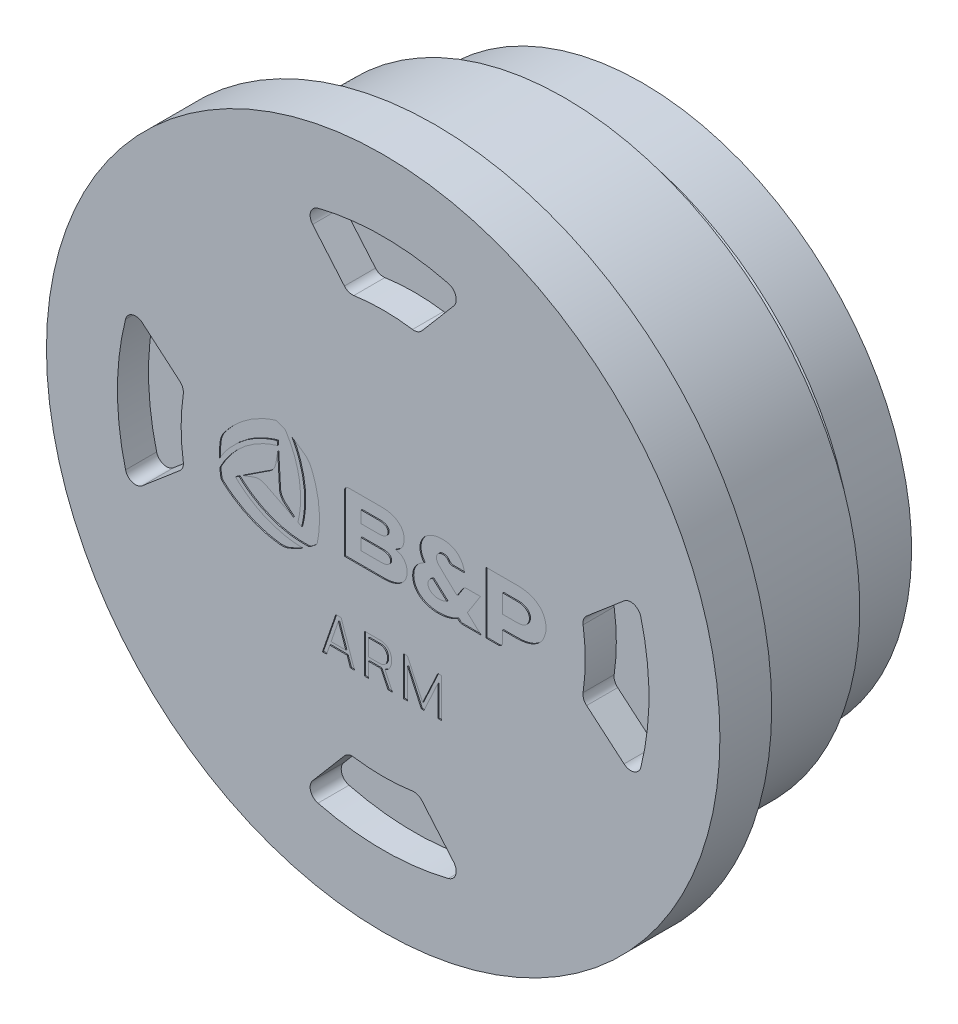
from build123d import *

# Parameters (mm, degrees)
CORTAR_EXTRUIR1_DEPTH = 0.1
CORTAR_EXTRUIR2_DEPTH = 3
MATRIZC1_COUNT        = 4
REDONDEO1_R           = 1


with BuildPart() as part:
    # Croquis1 → Revolución1 (revolve)
    with BuildSketch(Plane(origin=(0, 0, 0), x_dir=(0, 0, -1), z_dir=(1, 0, 0))):
        with BuildLine():
            Line((0, 20), (-20, 20))
            Line((-20, 20), (-20, 0))
            Line((-20, 0), (-25, 0))
            Line((-25, 0), (-25, 32.5))
            Line((-25, 32.5), (-20, 32.5))
            Line((-20, 32.5), (-20, 28.5))
            Line((-20, 28.5), (-7.5, 28.5))
            Line((-7.5, 28.5), (-7.5, 26))
            ThreePointArc((-7.5, 26), (-6.5, 25.618033989), (-5.5, 26))
            Line((-5.5, 26), (0, 26))
            Line((0, 26), (0, 20))
        make_face()
    revolve(axis=Axis((0, 0, 20), (0, 0, 1)))

    # Croquis2 → Cortar-Extruir1 (cut)
    # profile 1 of 7: a face of its own
    with BuildSketch(Plane.XY.offset(25)):
        with BuildLine():
            Line((12.994078069, 2.960293032), (9.929828115, 2.960293032))
            Line((9.929828115, 2.960293032), (9.929828115, -2.948296044))
            Line((9.929828115, -2.948296044), (11.106882982, -2.948296044))
            add(Edge.make_bspline(
                [(11.106882982, -2.948296044), (11.341278499, -2.948296044), (11.53192279, -2.757643262), (11.53192279, -2.523247745)],
                knots=[6, 6, 6, 6, 7, 7, 7, 7], degree=3))
            Line((11.53192279, -2.523247745), (11.53192279, -1.497959455))
            Line((11.53192279, -1.497959455), (12.861372525, -1.497959455))
            add(Edge.make_bspline(
                [(12.861372525, -1.497959455), (13.44013171, -1.497959455), (13.952045678, -1.402535424), (14.382926907, -1.214319398)],
                knots=[9, 9, 9, 9, 10, 10, 10, 10], degree=3))
            add(Edge.make_bspline(
                [(14.382926907, -1.214319398), (14.813748703, -1.026111863), (15.148645532, -0.754918789), (15.378311875, -0.408262703)],
                knots=[10, 10, 10, 10, 11, 11, 11, 11], degree=3))
            add(Edge.make_bspline(
                [(15.378311875, -0.408262703), (15.490504521, -0.238827526), (15.722675543, 0.272322303), (15.72378779, 0.771160996)],
                knots=[11, 11, 11, 11, 12, 12, 12, 12], degree=3))
            add(Edge.make_bspline(
                [(15.72378779, 0.771160996), (15.724967961, 1.285087198), (15.478889602, 1.77537602), (15.392567321, 1.906621208)],
                knots=[12, 12, 12, 12, 13, 13, 13, 13], degree=3))
            add(Edge.make_bspline(
                [(15.392567321, 1.906621208), (15.172291402, 2.24117842), (14.853322634, 2.503320688), (14.444482581, 2.685627369)],
                knots=[1, 1, 1, 1, 2, 2, 2, 2], degree=3))
            add(Edge.make_bspline(
                [(14.444482581, 2.685627369), (14.035370834, 2.867925559), (13.547382921, 2.960293032), (12.994078069, 2.960293032)],
                knots=[2, 2, 2, 2, 3, 3, 3, 3], degree=3))
        make_face()
        with BuildLine():
            Line((12.956176754, -0.165172977), (11.53192279, -0.165172977))
            Line((11.53192279, -0.165172977), (11.53192279, 1.618464239))
            Line((11.53192279, 1.618464239), (12.956176754, 1.618464239))
            add(Edge.make_bspline(
                [(12.956176754, 1.618464239), (13.308326153, 1.618464239), (13.593774673, 1.536667361), (13.804592244, 1.3752981)],
                knots=[5, 5, 5, 5, 6, 6, 6, 6], degree=3))
            add(Edge.make_bspline(
                [(13.804592244, 1.3752981), (13.940014727, 1.271527968), (14.033282187, 1.142091244), (14.08183051, 0.990460515)],
                knots=[6, 6, 6, 6, 7, 7, 7, 7], degree=3))
            add(Edge.make_bspline(
                [(14.08183051, 0.990460515), (14.126277952, 0.851837136), (14.128086416, 0.698406434), (14.08705213, 0.546852119)],
                knots=[7, 7, 7, 7, 8, 8, 8, 8], degree=3))
            add(Edge.make_bspline(
                [(14.08705213, 0.546852119), (14.040032085, 0.373171723), (13.945015595, 0.224470195), (13.804592244, 0.105043697)],
                knots=[0, 0, 0, 0, 1, 1, 1, 1], degree=3))
            add(Edge.make_bspline(
                [(13.804592244, 0.105043697), (13.593706749, -0.07426586), (13.30825823, -0.165172977), (12.956176754, -0.165172977)],
                knots=[1, 1, 1, 1, 2, 2, 2, 2], degree=3))
        make_face(mode=Mode.SUBTRACT)
    # profile 2 of 7: a face of its own
    with BuildSketch(Plane.XY.offset(25)):
        with BuildLine():
            Line((8.128700597, -1.723168318), (8.166678326, -1.669126681))
            Line((8.166678326, -1.669126681), (9.389564576, 0.249160388))
            Line((9.389564576, 0.249160388), (8.046971643, 0.249160388))
            add(Edge.make_bspline(
                [(8.046971643, 0.249160388), (7.902235149, 0.249160388), (7.768901314, 0.176618088), (7.690228917, 0.055179355)],
                knots=[3, 3, 3, 3, 4, 4, 4, 4], degree=3))
            Line((7.690228917, 0.055179355), (7.133315629, -0.804502946))
            Line((7.133315629, -0.804502946), (6.071509965, 0.177178456))
            add(Edge.make_bspline(
                [(6.071509965, 0.177178456), (5.712958776, 0.50574991), (5.465768169, 0.749603775), (5.336883323, 0.902066567)],
                knots=[6, 6, 6, 6, 7, 7, 7, 7], degree=3))
            add(Edge.make_bspline(
                [(5.336883323, 0.902066567), (5.207930553, 1.054385021), (5.142554182, 1.216518422), (5.142554182, 1.383864951)],
                knots=[7, 7, 7, 7, 8, 8, 8, 8], degree=3))
            add(Edge.make_bspline(
                [(5.142554182, 1.383864951), (5.142554182, 1.557256673), (5.201528763, 1.698104546), (5.317966627, 1.802647306)],
                knots=[8, 8, 8, 8, 9, 9, 9, 9], degree=3))
            add(Edge.make_bspline(
                [(5.317966627, 1.802647306), (5.434396001, 1.9072495), (5.582689988, 1.960323227), (5.758730726, 1.960323227)],
                knots=[9, 9, 9, 9, 10, 10, 10, 10], degree=3))
            add(Edge.make_bspline(
                [(5.758730726, 1.960323227), (5.941028916, 1.960323227), (6.094187924, 1.899667539), (6.21375027, 1.780181608)],
                knots=[10, 10, 10, 10, 11, 11, 11, 11], degree=3))
            add(Edge.make_bspline(
                [(6.21375027, 1.780181608), (6.249291242, 1.744564221), (6.280935104, 1.703742196), (6.307781869, 1.658734385)],
                knots=[11, 11, 11, 11, 12, 12, 12, 12], degree=3))
            add(Edge.make_bspline(
                [(6.307781869, 1.658734385), (6.382344894, 1.533814574), (6.523676722, 1.456262915), (6.676555545, 1.456262915)],
                knots=[12, 12, 12, 12, 13, 13, 13, 13], degree=3))
            Line((6.676555545, 1.456262915), (7.851385917, 1.456262915))
            Line((7.851385917, 1.456262915), (7.848117099, 1.476996564))
            add(Edge.make_bspline(
                [(7.848117099, 1.476996564), (7.769317345, 1.975835257), (7.560724269, 2.382374401), (7.228119857, 2.685279261)],
                knots=[15, 15, 15, 15, 16, 16, 16, 16], degree=3))
            add(Edge.make_bspline(
                [(7.228119857, 2.685279261), (6.850719896, 3.028878789), (6.340402131, 3.203102573), (5.711362573, 3.203102573)],
                knots=[16, 16, 16, 16, 17, 17, 17, 17], degree=3))
            add(Edge.make_bspline(
                [(5.711362573, 3.203102573), (5.283741672, 3.203102573), (4.902588938, 3.122774541), (4.578474964, 2.964470328)],
                knots=[17, 17, 17, 17, 18, 18, 18, 18], degree=3))
            add(Edge.make_bspline(
                [(4.578474964, 2.964470328), (4.254556271, 2.806098191), (3.999367671, 2.589430708), (3.820126039, 2.320538542)],
                knots=[18, 18, 18, 18, 19, 19, 19, 19], degree=3))
            add(Edge.make_bspline(
                [(3.820126039, 2.320538542), (3.640816482, 2.051646377), (3.549909364, 1.748597179), (3.549909364, 1.419889879)],
                knots=[19, 19, 19, 19, 20, 20, 20, 20], degree=3))
            add(Edge.make_bspline(
                [(3.549909364, 1.419889879), (3.549909364, 1.061202843), (3.680670597, 0.700563006), (3.938508213, 0.348209836)],
                knots=[20, 20, 20, 20, 21, 21, 21, 21], degree=3))
            add(Edge.make_bspline(
                [(3.938508213, 0.348209836), (3.604995325, 0.174741701), (3.337079559, -0.049499253), (3.142257973, -0.318255571)],
                knots=[21, 21, 21, 21, 22, 22, 22, 22], degree=3))
            add(Edge.make_bspline(
                [(3.142257973, -0.318255571), (2.94730054, -0.587079814), (2.84839543, -0.905216519), (2.84839543, -1.263835632)],
                knots=[22, 22, 22, 22, 23, 23, 23, 23], degree=3))
            add(Edge.make_bspline(
                [(2.84839543, -1.263835632), (2.84839543, -1.640539377), (2.950425021, -1.978365408), (3.151716321, -2.267982732)],
                knots=[23, 23, 23, 23, 24, 24, 24, 24], degree=3))
            add(Edge.make_bspline(
                [(3.151716321, -2.267982732), (3.353007621, -2.557888732), (3.643185314, -2.786578675), (4.014387256, -2.947939445)],
                knots=[24, 24, 24, 24, 25, 25, 25, 25], degree=3))
            add(Edge.make_bspline(
                [(4.014387256, -2.947939445), (4.38553477, -3.109297194), (4.819271323, -3.191072128), (5.303718724, -3.191057101)],
                knots=[25, 25, 25, 25, 26, 26, 26, 26], degree=3))
            add(Edge.make_bspline(
                [(5.303718724, -3.191057101), (6.027214402, -3.191046281), (6.655555206, -3.021397936), (7.171293357, -2.686765087)],
                knots=[26, 26, 26, 26, 27, 27, 27, 27], degree=3))
            Line((7.171293357, -2.686765087), (7.34607751, -2.841520298))
            add(Edge.make_bspline(
                [(7.34607751, -2.841520298), (7.423773507, -2.910386239), (7.523858788, -2.948287553), (7.627773256, -2.948287553)],
                knots=[29, 29, 29, 29, 30, 30, 30, 30], degree=3))
            Line((7.627773256, -2.948287553), (9.453276821, -2.948287553))
            Line((9.453276821, -2.948287553), (8.128700597, -1.723168318))
        make_face()
        with BuildLine():
            Line((4.772804105, -0.543405002), (6.147397498, -1.777209955))
            add(Edge.make_bspline(
                [(6.147397498, -1.777209955), (5.883226016, -1.902690135), (5.612109355, -1.966334457), (5.341612497, -1.966334457)],
                knots=[0, 0, 0, 0, 1, 1, 1, 1], degree=3))
            add(Edge.make_bspline(
                [(5.341612497, -1.966334457), (5.058388472, -1.966334457), (4.81439876, -1.892043126), (4.616376279, -1.745634016)],
                knots=[1, 1, 1, 1, 2, 2, 2, 2], degree=3))
            add(Edge.make_bspline(
                [(4.616376279, -1.745634016), (4.418285874, -1.59929283), (4.317784561, -1.419015364), (4.317784561, -1.209793995)],
                knots=[2, 2, 2, 2, 3, 3, 3, 3], degree=3))
            add(Edge.make_bspline(
                [(4.317784561, -1.209793995), (4.317784561, -1.072359278), (4.359234879, -0.945070634), (4.441031757, -0.831561971)],
                knots=[3, 3, 3, 3, 4, 4, 4, 4], degree=3))
            add(Edge.make_bspline(
                [(4.441031757, -0.831561971), (4.522692788, -0.718053308), (4.634325064, -0.621160431), (4.772804105, -0.543405002)],
                knots=[4, 4, 4, 4, 5, 5, 5, 5], degree=3))
        make_face(mode=Mode.SUBTRACT)
    # profile 3 of 7: a face of its own
    with BuildSketch(Plane.XY.offset(25)):
        with BuildLine():
            Line((-0.194526544, 2.960301523), (-3.313803024, 2.960301523))
            add(Edge.make_bspline(
                [(-3.313803024, 2.960301523), (-3.548198541, 2.960301523), (-3.738842832, 2.769657232), (-3.738842832, 2.535261715)],
                knots=[6, 6, 6, 6, 7, 7, 7, 7], degree=3))
            Line((-3.738842832, 2.535261715), (-3.738842832, -2.948355477))
            Line((-3.738842832, -2.948355477), (-0.004926577, -2.948355477))
            add(Edge.make_bspline(
                [(-0.004926577, -2.948355477), (0.705909859, -2.948355477), (1.275210696, -2.792275758), (1.687243153, -2.484497387)],
                knots=[9, 9, 9, 9, 10, 10, 10, 10], degree=3))
            add(Edge.make_bspline(
                [(1.687243153, -2.484497387), (2.099284101, -2.176727507), (2.308148871, -1.760101723), (2.308148871, -1.246234954)],
                knots=[10, 10, 10, 10, 11, 11, 11, 11], degree=3))
            add(Edge.make_bspline(
                [(2.308148871, -1.246234954), (2.308148871, -1.177793535), (2.303835729, -1.1086559), (2.295285858, -1.040842773)],
                knots=[11, 11, 11, 11, 12, 12, 12, 12], degree=3))
            add(Edge.make_bspline(
                [(2.295285858, -1.040842773), (2.264958014, -0.799213403), (2.174466927, -0.57789316), (2.026393692, -0.38300365)],
                knots=[0, 0, 0, 0, 1, 1, 1, 1], degree=3))
            add(Edge.make_bspline(
                [(2.026393692, -0.38300365), (1.846871874, -0.146944007), (1.563995958, 0.017133704), (1.208093785, 0.091560881)],
                knots=[1, 1, 1, 1, 2, 2, 2, 2], degree=3))
            add(Edge.make_bspline(
                [(1.208093785, 0.091560881), (1.82176565, 0.38764792), (1.992100813, 0.730755003), (2.023812599, 1.330239346)],
                knots=[2, 2, 2, 2, 3, 3, 3, 3], degree=3))
            add(Edge.make_bspline(
                [(2.023812599, 1.330239346), (2.023812599, 1.832066674), (1.826078792, 2.233537026), (1.436019588, 2.523502459)],
                knots=[3, 3, 3, 3, 4, 4, 4, 4], degree=3))
            add(Edge.make_bspline(
                [(1.436019588, 2.523502459), (1.045824537, 2.813399968), (0.497248859, 2.960301523), (-0.194526544, 2.960301523)],
                knots=[4, 4, 4, 4, 5, 5, 5, 5], degree=3))
        make_face()
        with BuildLine():
            Line((-0.441029425, 0.573359266), (-2.136748157, 0.573359266))
            Line((-2.136748157, 0.573359266), (-2.136748157, 1.717513686))
            Line((-2.136748157, 1.717513686), (-0.441029425, 1.717513686))
            add(Edge.make_bspline(
                [(-0.441029425, 1.717513686), (-0.132970869, 1.717513686), (0.101424648, 1.665976729), (0.255763826, 1.564431092)],
                knots=[5, 5, 5, 5, 6, 6, 6, 6], degree=3))
            add(Edge.make_bspline(
                [(0.255763826, 1.564431092), (0.335607904, 1.511705474), (0.395567376, 1.445488549), (0.433961135, 1.367656705)],
                knots=[6, 6, 6, 6, 7, 7, 7, 7], degree=3))
            add(Edge.make_bspline(
                [(0.433961135, 1.367656705), (0.492247991, 1.249418868), (0.49301213, 1.103357866), (0.43618563, 0.976909776)],
                knots=[7, 7, 7, 7, 8, 8, 8, 8], degree=3))
            add(Edge.make_bspline(
                [(0.43618563, 0.976909776), (0.396331515, 0.888227153), (0.332483423, 0.81157548), (0.246305479, 0.748983973)],
                knots=[0, 0, 0, 0, 1, 1, 1, 1], degree=3))
            add(Edge.make_bspline(
                [(0.246305479, 0.748983973), (0.085912618, 0.632410261), (-0.145349928, 0.573359266), (-0.441029425, 0.573359266)],
                knots=[1, 1, 1, 1, 2, 2, 2, 2], degree=3))
        make_face(mode=Mode.SUBTRACT)
        with BuildLine():
            Line((-0.213519653, -1.687483008), (-2.136748157, -1.687483008))
            Line((-2.136748157, -1.687483008), (-2.136748157, -0.588395832))
            Line((-2.136748157, -0.588395832), (-0.185000272, -0.588395832))
            add(Edge.make_bspline(
                [(-0.185000272, -0.588395832), (0.11039904, -0.588395832), (0.340065384, -0.636876232), (0.497529043, -0.732512523)],
                knots=[6, 6, 6, 6, 7, 7, 7, 7], degree=3))
            add(Edge.make_bspline(
                [(0.497529043, -0.732512523), (0.585167343, -0.785857944), (0.649159772, -0.854647471), (0.687833717, -0.936996228)],
                knots=[7, 7, 7, 7, 8, 8, 8, 8], degree=3))
            add(Edge.make_bspline(
                [(0.687833717, -0.936996228), (0.735889595, -1.039382417), (0.737214103, -1.161381519), (0.691374229, -1.271621363)],
                knots=[0, 0, 0, 0, 1, 1, 1, 1], degree=3))
            add(Edge.make_bspline(
                [(0.691374229, -1.271621363), (0.652912546, -1.364133174), (0.587672022, -1.444953651), (0.497529043, -1.511858301)],
                knots=[1, 1, 1, 1, 2, 2, 2, 2], degree=3))
            add(Edge.make_bspline(
                [(0.497529043, -1.511858301), (0.340269154, -1.628432013), (0.101008616, -1.687483008), (-0.213519653, -1.687483008)],
                knots=[2, 2, 2, 2, 3, 3, 3, 3], degree=3))
        make_face(mode=Mode.SUBTRACT)
    # profile 4 of 7: a face of its own
    with BuildSketch(Plane.XY.offset(25)):
        with BuildLine():
            Line((-7.869228572, -2.537732432), (-8.231464612, -2.355086134))
            add(Edge.make_bspline(
                [(-8.231464612, -2.355086134), (-8.116355501, -1.884070605), (-8.037479333, -1.397823231), (-7.998601619, -0.898984538)],
                knots=[6, 6, 6, 6, 7, 7, 7, 7], degree=3))
            add(Edge.make_bspline(
                [(-7.998601619, -0.898984538), (-7.840017221, 1.133999857), (-8.366398895, 3.065302767), (-9.383137314, 4.667465366)],
                knots=[7, 7, 7, 7, 8, 8, 8, 8], degree=3))
            add(Edge.make_bspline(
                [(-9.383137314, 4.667465366), (-9.431613469, 4.743836854), (-9.501931275, 4.803864249), (-9.585048416, 4.839685406)],
                knots=[8, 8, 8, 8, 9, 9, 9, 9], degree=3))
            add(Edge.make_bspline(
                [(-9.585048416, 4.839685406), (-9.779313879, 4.923358671), (-9.977192023, 5.000630146), (-10.178411154, 5.07129606)],
                knots=[9, 9, 9, 9, 10, 10, 10, 10], degree=3))
            add(Edge.make_bspline(
                [(-10.178411154, 5.07129606), (-10.270638535, 5.103636137), (-10.371008246, 5.104892722), (-10.463999766, 5.074912986)],
                knots=[10, 10, 10, 10, 11, 11, 11, 11], degree=3))
            add(Edge.make_bspline(
                [(-10.463999766, 5.074912986), (-10.859900391, 4.947072464), (-11.252252013, 4.792801209), (-11.638690046, 4.611063387)],
                knots=[11, 11, 11, 11, 12, 12, 12, 12], degree=3))
            add(Edge.make_bspline(
                [(-11.638690046, 4.611063387), (-13.190296332, 3.88158195), (-14.462639382, 2.79890679), (-15.405022793, 1.504030118)],
                knots=[12, 12, 12, 12, 13, 13, 13, 13], degree=3))
            add(Edge.make_bspline(
                [(-15.405022793, 1.504030118), (-15.57396977, 1.271859096), (-15.682193136, 1.001082052), (-15.72378779, 0.716958041)],
                knots=[13, 13, 13, 13, 14, 14, 14, 14], degree=3))
            add(Edge.make_bspline(
                [(-15.72378779, 0.716958041), (-15.797862615, 0.21137794), (-15.830482877, -0.301860536), (-15.819840114, -0.817535768)],
                knots=[14, 14, 14, 14, 15, 15, 15, 15], degree=3))
            add(Edge.make_bspline(
                [(-15.819840114, -0.817535768), (-15.515194714, -0.303601076), (-15.16207316, 0.180837835), (-14.7622075, 0.632316866)],
                knots=[15, 15, 15, 15, 16, 16, 16, 16], degree=3))
            add(Edge.make_bspline(
                [(-14.7622075, 0.632316866), (-13.920189555, 1.582829871), (-12.907488338, 2.3447278), (-11.752202954, 2.896699653)],
                knots=[16, 16, 16, 16, 17, 17, 17, 17], degree=3))
            add(Edge.make_bspline(
                [(-11.752202954, 2.896699653), (-11.256633079, 3.133531926), (-10.74749973, 3.325364878), (-10.22758777, 3.472122096)],
                knots=[17, 17, 17, 17, 18, 18, 18, 18], degree=3))
            Line((-10.22758777, 3.472122096), (-10.204701795, 3.067111231))
            add(Edge.make_bspline(
                [(-10.204701795, 3.067111231), (-10.670156087, 2.931272716), (-11.130673189, 2.756412149), (-11.58214373, 2.540729557)],
                knots=[19, 19, 19, 19, 20, 20, 20, 20], degree=3))
            add(Edge.make_bspline(
                [(-11.58214373, 2.540729557), (-13.422047077, 1.661570192), (-14.831345135, 0.240033168), (-15.710500255, -1.441498043)],
                knots=[20, 20, 20, 20, 21, 21, 21, 21], degree=3))
            add(Edge.make_bspline(
                [(-15.710500255, -1.441498043), (-15.752443018, -1.521698719), (-15.769275311, -1.612597346), (-15.758704716, -1.702468631)],
                knots=[21, 21, 21, 21, 22, 22, 22, 22], degree=3))
            add(Edge.make_bspline(
                [(-15.758704716, -1.702468631), (-15.734082446, -1.912589986), (-15.702086231, -2.122634927), (-15.662648148, -2.332204404)],
                knots=[22, 22, 22, 22, 23, 23, 23, 23], degree=3))
            add(Edge.make_bspline(
                [(-15.662648148, -2.332204404), (-15.644563515, -2.428188804), (-15.595459068, -2.515759179), (-15.522984691, -2.581271398)],
                knots=[23, 23, 23, 23, 24, 24, 24, 24], degree=3))
            add(Edge.make_bspline(
                [(-15.522984691, -2.581271398), (-15.214374257, -2.860258694), (-14.884550464, -3.122893407), (-14.533933589, -3.366747272)],
                knots=[24, 24, 24, 24, 25, 25, 25, 25], degree=3))
            add(Edge.make_bspline(
                [(-14.533933589, -3.366747272), (-13.126376071, -4.345711734), (-11.552584271, -4.906241948), (-9.960015867, -5.074912986)],
                knots=[25, 25, 25, 25, 26, 26, 26, 26], degree=3))
            add(Edge.make_bspline(
                [(-9.960015867, -5.074912986), (-9.674495179, -5.105172907), (-9.385850009, -5.063510328), (-9.118970077, -4.957439289)],
                knots=[26, 26, 26, 26, 27, 27, 27, 27], degree=3))
            add(Edge.make_bspline(
                [(-9.118970077, -4.957439289), (-8.644129606, -4.768807231), (-8.183336565, -4.540465397), (-7.742084266, -4.273373204)],
                knots=[27, 27, 27, 27, 28, 28, 28, 28], degree=3))
            add(Edge.make_bspline(
                [(-7.742084266, -4.273373204), (-8.339412038, -4.266563872), (-8.935559639, -4.20291955), (-9.526485621, -4.082380805)],
                knots=[28, 28, 28, 28, 29, 29, 29, 29], degree=3))
            add(Edge.make_bspline(
                [(-9.526485621, -4.082380805), (-10.770661644, -3.8284403), (-11.936797808, -3.33238647), (-12.992554035, -2.607846468)],
                knots=[29, 29, 29, 29, 30, 30, 30, 30], degree=3))
            add(Edge.make_bspline(
                [(-12.992554035, -2.607846468), (-13.445349084, -2.297079463), (-13.866079995, -1.952095993), (-14.253146319, -1.575179987)],
                knots=[30, 30, 30, 30, 31, 31, 31, 31], degree=3))
            Line((-14.253146319, -1.575179987), (-13.913443902, -1.35261165))
            add(Edge.make_bspline(
                [(-13.913443902, -1.35261165), (-13.563102966, -1.687788664), (-13.181737971, -1.999455655), (-12.769285237, -2.282543833)],
                knots=[32, 32, 32, 32, 33, 33, 33, 33], degree=3))
            add(Edge.make_bspline(
                [(-12.769285237, -2.282543833), (-11.087966287, -3.436436786), (-9.152218632, -3.946126258), (-7.256325092, -3.866766136)],
                knots=[33, 33, 33, 33, 34, 34, 34, 34], degree=3))
            add(Edge.make_bspline(
                [(-7.256325092, -3.866766136), (-7.165974098, -3.862936949), (-7.078823999, -3.832057226), (-7.006277453, -3.77801559)],
                knots=[34, 34, 34, 34, 35, 35, 35, 35], degree=3))
            add(Edge.make_bspline(
                [(-7.006277453, -3.77801559), (-6.836706429, -3.651635423), (-6.670888178, -3.518997803), (-6.509179299, -3.380102731)],
                knots=[35, 35, 35, 35, 36, 36, 36, 36], degree=3))
            add(Edge.make_bspline(
                [(-6.509179299, -3.380102731), (-6.434964382, -3.316390485), (-6.383563271, -3.230068204), (-6.363046128, -3.134431912)],
                knots=[36, 36, 36, 36, 37, 37, 37, 37], degree=3))
            add(Edge.make_bspline(
                [(-6.363046128, -3.134431912), (-6.275755937, -2.727688998), (-6.213228108, -2.310638692), (-6.177339027, -1.885114929)],
                knots=[37, 37, 37, 37, 38, 38, 38, 38], degree=3))
            add(Edge.make_bspline(
                [(-6.177339027, -1.885114929), (-6.033290259, -0.17666903), (-6.334739009, 1.466536344), (-6.984924002, 2.930084055)],
                knots=[38, 38, 38, 38, 39, 39, 39, 39], degree=3))
            add(Edge.make_bspline(
                [(-6.984924002, 2.930084055), (-7.101497713, 3.192514997), (-7.281919517, 3.421620972), (-7.507204794, 3.599750357)],
                knots=[0, 0, 0, 0, 1, 1, 1, 1], degree=3))
            add(Edge.make_bspline(
                [(-7.507204794, 3.599750357), (-7.908042609, 3.916638968), (-8.336143219, 4.201527119), (-8.78810196, 4.450110157)],
                knots=[1, 1, 1, 1, 2, 2, 2, 2], degree=3))
            add(Edge.make_bspline(
                [(-8.78810196, 4.450110157), (-8.495283741, 3.929366134), (-8.252334108, 3.381282901), (-8.061337464, 2.809273615)],
                knots=[2, 2, 2, 2, 3, 3, 3, 3], degree=3))
            add(Edge.make_bspline(
                [(-8.061337464, 2.809273615), (-7.659107217, 1.604811615), (-7.50567227, 0.346868347), (-7.605273596, -0.929719923)],
                knots=[3, 3, 3, 3, 4, 4, 4, 4], degree=3))
            add(Edge.make_bspline(
                [(-7.605273596, -0.929719923), (-7.647980498, -1.477251277), (-7.736382937, -2.014135622), (-7.869228572, -2.537732432)],
                knots=[4, 4, 4, 4, 5, 5, 5, 5], degree=3))
        make_face()
        with BuildLine():
            Line((-12.471041627, -0.700053579), (-13.512117887, -1.089628829))
            Line((-13.512117887, -1.089628829), (-10.948926877, 0.589881658))
            add(Edge.make_bspline(
                [(-10.948926877, 0.589881658), (-10.635727361, 0.795070069), (-10.42247728, 1.121833059), (-10.360781513, 1.491235028)],
                knots=[3, 3, 3, 3, 4, 4, 4, 4], degree=3))
            Line((-10.360781513, 1.491235028), (-10.177579091, 2.587673188))
            Line((-10.177579091, 2.587673188), (-10.00466708, -0.471924006))
            add(Edge.make_bspline(
                [(-10.00466708, -0.471924006), (-9.983593813, -0.845774964), (-9.807204967, -1.193814991), (-9.518207445, -1.431903848)],
                knots=[6, 6, 6, 6, 7, 7, 7, 7], degree=3))
            Line((-9.518207445, -1.431903848), (-8.660193515, -2.138843173))
            Line((-8.660193515, -2.138843173), (-11.39636446, -0.758756467))
            add(Edge.make_bspline(
                [(-11.39636446, -0.758756467), (-11.730709411, -0.590161843), (-12.120280415, -0.568876315), (-12.471041627, -0.700053579)],
                knots=[0, 0, 0, 0, 1, 1, 1, 1], degree=3))
        make_face(mode=Mode.SUBTRACT)
    # profile 5 of 7: a face of its own
    with BuildSketch(Plane.XY.offset(25)):
        Polygon((-5.86313803, -12), (-4.568043105, -8.239388889), (-4.058770071, -8.239388889), (-2.762919548, -12), (-3.162630875, -12), (-3.478743571, -11.088748845), (-5.149449904, -11.088748845), (-5.463426703, -12), align=None)
        Polygon((-4.316928443, -8.672531643), (-5.02526505, -10.728328612), (-3.603773219, -10.728328612), align=None, mode=Mode.SUBTRACT)
    # profile 6 of 7: a face of its own
    with BuildSketch(Plane.XY.offset(25)):
        with BuildLine():
            Line((-1.810412743, -12), (-1.810412743, -8.239388889))
            Line((-1.810412743, -8.239388889), (-0.358909037, -8.239388889))
            add(Edge.make_bspline(
                [(-0.358909037, -8.239388889), (-0.317526284, -8.23863027), (-0.229363923, -8.243655611), (-0.141351328, -8.251352154), (-0.095205345, -8.260545632)],
                knots=[0, 0, 0, 0, 0.468273276, 1, 1, 1, 1], degree=3))
            add(Edge.make_bspline(
                [(-0.095205345, -8.260545632), (-0.002094788, -8.274783329), (0.133731359, -8.308905424), (0.297778897, -8.3896687), (0.406271957, -8.463615003), (0.503032709, -8.54910114), (0.588244466, -8.645114725), (0.659141554, -8.752668093), (0.718273022, -8.869281753), (0.763973052, -8.994195318), (0.809635356, -9.172521248), (0.820792369, -9.312427956), (0.821334997, -9.406787757)],
                knots=[0, 0, 0, 0, 0.175501132, 0.258082867, 0.339066553, 0.419088444, 0.497787339, 0.57720859, 0.658113581, 0.740559553, 0.824220764, 1, 1, 1, 1], degree=3))
            add(Edge.make_bspline(
                [(0.821334997, -9.406787757), (0.82105613, -9.475737579), (0.814506322, -9.577804089), (0.790827388, -9.710280824), (0.766976154, -9.804954094), (0.734991303, -9.895825862), (0.696163189, -9.983146914), (0.651000058, -10.067385113), (0.598046675, -10.147021524), (0.539604922, -10.221944901), (0.474265762, -10.289868672), (0.401992921, -10.349367883), (0.324490829, -10.402662863), (0.24585986, -10.446601013), (0.191797845, -10.46976135), (0.166535716, -10.479494888)],
                knots=[0, 0, 0, 0, 0.132776813, 0.196316255, 0.258884263, 0.320534205, 0.381536171, 0.442720953, 0.504317476, 0.565433045, 0.625446013, 0.685358987, 0.745346483, 0.806338812, 0.858431897, 0.858431897, 0.858431897, 0.858431897], degree=3))
            Line((0.166535716, -10.479494888), (0.908228763, -12))
            Line((0.908228763, -12), (0.466203949, -12))
            Line((0.466203949, -12), (-0.225621555, -10.571919831))
            Line((-0.225621555, -10.571919831), (-1.426568973, -10.571919831))
            Line((-1.426568973, -10.571919831), (-1.426568973, -12))
            Line((-1.426568973, -12), (-1.810412743, -12))
        make_face()
        with BuildLine():
            Line((-1.426568973, -10.206210412), (-0.368731811, -10.206210412))
            add(Edge.make_bspline(
                [(-0.368731811, -10.206210412), (-0.332191044, -10.205437528), (-0.254285816, -10.202874731), (-0.177226056, -10.190762891), (-0.136763233, -10.182786875)],
                knots=[0, 0, 0, 0, 0.469850266, 1, 1, 1, 1], degree=3))
            add(Edge.make_bspline(
                [(-0.136763233, -10.182786875), (-0.075915789, -10.169769413), (0.011501888, -10.140365364), (0.114812373, -10.079004829), (0.18188497, -10.024945738), (0.23970224, -9.962707278), (0.28997143, -9.894930326), (0.332529398, -9.821942651), (0.367109959, -9.744037177), (0.394130201, -9.662486664), (0.420625906, -9.550562106), (0.427549677, -9.464213366), (0.427668453, -9.406787757)],
                knots=[0, 0, 0, 0, 0.179292451, 0.262884236, 0.344897148, 0.426485585, 0.506852628, 0.587464777, 0.669285019, 0.751857315, 0.834547397, 1, 1, 1, 1], degree=3))
            add(Edge.make_bspline(
                [(0.427668453, -9.406787757), (0.427526898, -9.349369117), (0.420670828, -9.262999664), (0.394007604, -9.150876501), (0.367130587, -9.068790399), (0.332515223, -8.990148029), (0.290146402, -8.916545883), (0.239963764, -8.84858641), (0.181368217, -8.787178085), (0.115116935, -8.732188957), (0.011380935, -8.671085061), (-0.075850821, -8.641463193), (-0.136763233, -8.628521845)],
                knots=[0, 0, 0, 0, 0.165137402, 0.247669952, 0.330772048, 0.41309796, 0.494182683, 0.57439662, 0.655303401, 0.73761658, 0.821049116, 1, 1, 1, 1], degree=3))
            add(Edge.make_bspline(
                [(-0.136763233, -8.628521845), (-0.177034792, -8.619410222), (-0.254439608, -8.61073547), (-0.332176176, -8.608052922), (-0.368731811, -8.6081207)],
                knots=[0, 0, 0, 0, 0.529955007, 1, 1, 1, 1], degree=3))
            Line((-0.368731811, -8.6081207), (-1.426568973, -8.6081207))
            Line((-1.426568973, -8.6081207), (-1.426568973, -10.206210412))
        make_face(mode=Mode.SUBTRACT)
    # profile 7 of 7: a face of its own
    with BuildSketch(Plane.XY.offset(25)):
        Polygon((1.980875646, -12), (1.980875646, -8.239388889), (2.332984301, -8.239388889), (3.810933936, -11.402322003), (5.281327591, -8.239388889), (5.639481031, -8.239388889), (5.639481031, -11.997733206), (5.273771612, -11.997733206), (5.273771612, -9.09623699), (3.934096406, -12), (3.686260271, -12), (2.348851859, -9.09623699), (2.348851859, -12), align=None)
    extrude(amount=-CORTAR_EXTRUIR1_DEPTH, mode=Mode.SUBTRACT)

    # Croquis3 → Cortar-Extruir2 (cut)
    with BuildSketch(Plane.XY.offset(25)):
        with BuildLine():
            Line((-7.81616141, 24.430106852), (-3.376382666, 19.205469015))
            ThreePointArc((-3.376382666, 19.205469015), (0, 19.5), (3.376382666, 19.205469015))
            Line((3.376382666, 19.205469015), (7.81616141, 24.430106852))
            ThreePointArc((7.81616141, 24.430106852), (0, 25.65), (-7.81616141, 24.430106852))
        make_face()
    cortar_extruir2 = extrude(amount=-CORTAR_EXTRUIR2_DEPTH, mode=Mode.SUBTRACT)

    # MatrizC1: Cortar-Extruir2 ×4 about axis
    matrizc1_axis = Axis((0, 0, 0), (0, 0, 1))
    for i in range(1, MATRIZC1_COUNT):
        add(cortar_extruir2.rotate(matrizc1_axis, i * 360 / MATRIZC1_COUNT), mode=Mode.SUBTRACT)

    # Redondeo1
    redondeo1_edges = [part.edges().sort_by_distance(p)[0] for p in [
        (-7.81616141, 24.430106852, 23.5),
        (7.81616141, 24.430106852, 23.5),
        (3.376382666, 19.205469015, 23.5),
        (-3.376382666, 19.205469015, 23.5),
        (24.430106852, 7.81616141, 23.5),
        (24.430106852, -7.81616141, 23.5),
        (19.205469015, -3.376382666, 23.5),
        (19.205469015, 3.376382666, 23.5),
        (7.81616141, -24.430106852, 23.5),
        (-7.81616141, -24.430106852, 23.5),
        (-3.376382666, -19.205469015, 23.5),
        (3.376382666, -19.205469015, 23.5),
        (-24.430106852, -7.81616141, 23.5),
        (-24.430106852, 7.81616141, 23.5),
        (-19.205469015, 3.376382666, 23.5),
        (-19.205469015, -3.376382666, 23.5),
    ]]
    fillet(redondeo1_edges, radius=REDONDEO1_R)


solid = part.part
